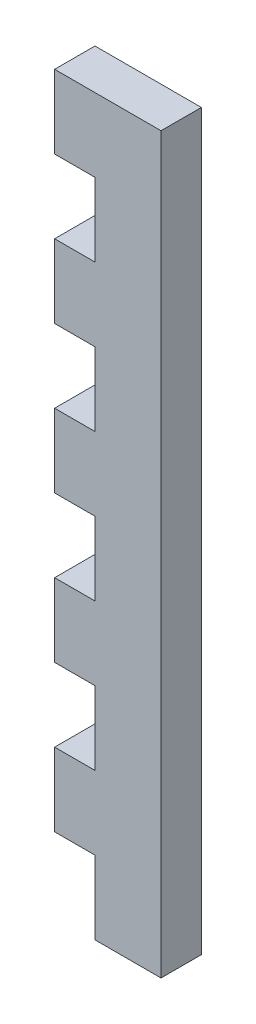
from build123d import *

# Parameters (mm, degrees)
SKETCH_1_W          = 14.5
SKETCH_1_H          = 100
EXTRUDE_1_DEPTH     = 5.5
SKETCH_2_W          = 5.5
SKETCH_2_H          = 10
CUT_EXTRUDE_1_DEPTH = 102.195355625


with BuildPart() as part:
    # ｽｹｯﾁ1 → ﾎﾞｽ - 押し出し1 (new body)
    with BuildSketch(Plane.XY):
        with Locations((7.25, -50)):
            Rectangle(SKETCH_1_W, SKETCH_1_H)
    extrude(amount=EXTRUDE_1_DEPTH)

    # ｽｹｯﾁ2 → ｶｯﾄ - 押し出し1 (cut, through all)
    with BuildSketch(Plane.XY.offset(5.5)):
        with Locations((2.75, -15)):
            Rectangle(SKETCH_2_W, SKETCH_2_H)
        with Locations((2.75, -35)):
            Rectangle(SKETCH_2_W, SKETCH_2_H)
        with Locations((2.75, -55)):
            Rectangle(SKETCH_2_W, SKETCH_2_H)
        with Locations((2.75, -75)):
            Rectangle(SKETCH_2_W, SKETCH_2_H)
        with Locations((2.75, -95)):
            Rectangle(SKETCH_2_W, SKETCH_2_H)
    extrude(amount=-CUT_EXTRUDE_1_DEPTH, mode=Mode.SUBTRACT)


solid = part.part
